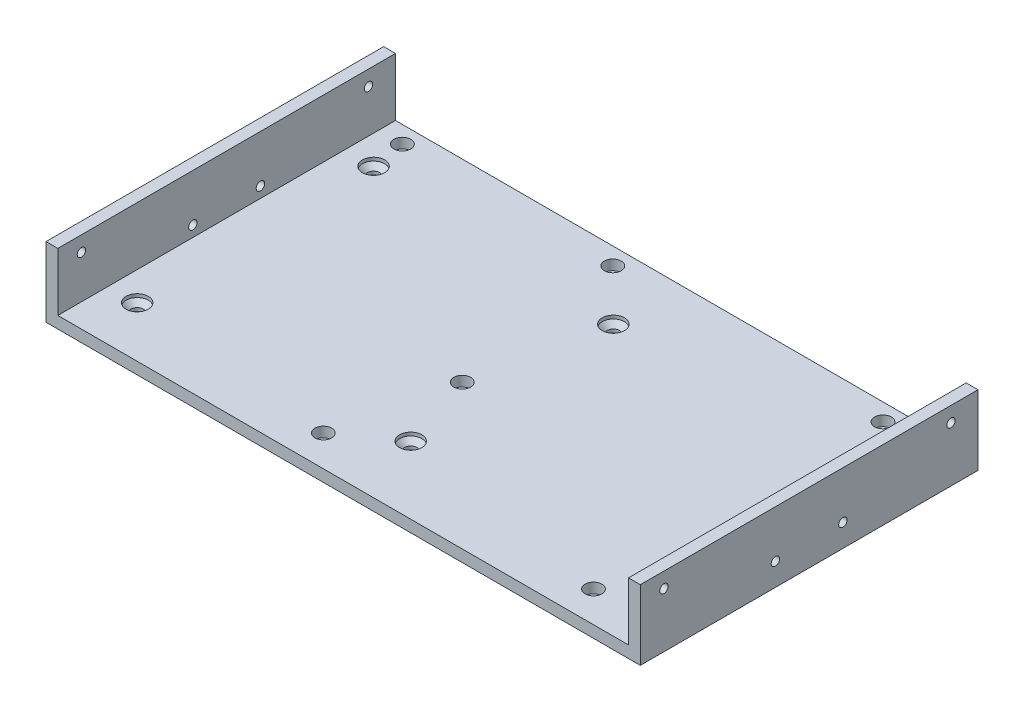
from build123d import *

# Parameters (mm, degrees)
EXTRUDE_1_DEPTH              = 100
HOLE_WIZARD_2_5_2_5_1_D      = 2.5
HOLE_WIZARD_2_5_2_5_1_DEPTH  = 3
HOLE_WIZARD_M2_51_D          = 2.05
HOLE_WIZARD_M2_51_DEPTH      = 3
HOLE_WIZARD_M31_D            = 2.5
HOLE_WIZARD_M31_DEPTH        = 3
HOLE_WIZARD_M41_D            = 3.3
HOLE_WIZARD_M41_DEPTH        = 3
HOLE_WIZARD_M32_D            = 2.5
HOLE_WIZARD_M32_DEPTH        = 3.5
HOLE_WIZARD_M33_D            = 2.5
HOLE_WIZARD_M33_DEPTH        = 5.5
HOLE_WIZARD_M31_2_AT_2_COUNT = 2
HOLE_WIZARD_M31_2_AT_2_PITCH = 76.164296097
HOLE_WIZARD_M31_2_AT_3_COUNT = 2
HOLE_WIZARD_M31_2_AT_3_PITCH = 152
HOLE_WIZARD_M31_2_AT_4_COUNT = 2
HOLE_WIZARD_M31_2_AT_4_PITCH = 70
HOLE_WIZARD_M31_2_AT_5_COUNT = 2
HOLE_WIZARD_M31_2_AT_5_PITCH = 100.004999875
HOLE_WIZARD_M31_2_AT_6_COUNT = 2
HOLE_WIZARD_M31_2_AT_6_PITCH = 167.343957166
HOLE_WIZARD_5_0_5_1_D        = 5
HOLE_WIZARD_5_0_5_1_DEPTH    = 3


with BuildPart() as part:
    # Эскиз1 → Вытянуть-Тонкостенный1 (new body)
    with BuildSketch(Plane.XY):
        Polygon((0, 20.7), (0, 0), (176, 0), (176, 20.7), (172.5, 20.7), (172.5, 3.5), (3.5, 3.5), (3.5, 20.7), align=None)
    extrude(amount=EXTRUDE_1_DEPTH)

    # Диаметр отверстия Ø2.5 (2.5)1
    with Locations(Plane(origin=(0, 0, 0), x_dir=(-1, 0, 0), z_dir=(0, -1, 0))):
        with Locations((-5, -92.5), (-171, -7.5)):
            Hole(HOLE_WIZARD_2_5_2_5_1_D / 2, depth=HOLE_WIZARD_2_5_2_5_1_DEPTH)

    # Отверстие обработанное метчиком M2,51
    with Locations(Plane(origin=(0, 0, 0), x_dir=(-1, 0, 0), z_dir=(0, -1, 0))):
        with Locations((-19.45, -93.75), (-60.45, -93.75), (-136.45, -93.75), (-136.45, -6.75), (-49.25, -6.75), (-19.45, -6.75)):
            Hole(HOLE_WIZARD_M2_51_D / 2, depth=HOLE_WIZARD_M2_51_DEPTH)

    # Hole Wizard M31
    with Locations(Plane(origin=(0, 0, 0), x_dir=(-1, 0, 0), z_dir=(0, -1, 0))):
        with Locations((-28, -87.5), (-88, -87.5), (-148, -87.5), (-148, -12.5), (-88, -12.5), (-28, -12.5)):
            Hole(HOLE_WIZARD_M31_D / 2, depth=HOLE_WIZARD_M31_DEPTH)

    # Отверстие обработанное метчиком M41
    with Locations(Plane(origin=(0, 0, 0), x_dir=(-1, 0, 0), z_dir=(0, -1, 0))):
        with Locations((-50.5, -87.5), (-125.7, -87.5), (-125.7, -12.5), (-50.5, -12.5)):
            Hole(HOLE_WIZARD_M41_D / 2, depth=HOLE_WIZARD_M41_DEPTH)

    # Отверстие обработанное метчиком M32
    with Locations(Plane(origin=(176, 0, 0), x_dir=(0, 0, -1), z_dir=(1, 0, 0))):
        with Locations((-93, 16.2), (-60, 6.7), (-40, 6.7), (-8, 16.2)):
            Hole(HOLE_WIZARD_M32_D / 2, depth=HOLE_WIZARD_M32_DEPTH)

    # Отверстие обработанное метчиком M33
    with Locations(Plane.ZY):
        with Locations((93, 16.2), (60, 6.7), (40, 6.7), (8, 16.2)):
            Hole(HOLE_WIZARD_M33_D / 2, depth=HOLE_WIZARD_M33_DEPTH)

    # Эскиз14 → Hole Wizard M31 2 (revolve, cut)
    with BuildSketch(Plane(origin=(12, 3.5, 15), x_dir=(0, 0, 1), z_dir=(1, 0, 0))):
        Polygon((0, 0), (0, 3.5), (1.8, 3.5), (1.8, 2.5), (3.3, 1), (3.3, 0), align=None)
    hole_wizard_m31_2 = revolve(axis=Axis((12, 9.85, 15), (0, -1, 0)), mode=Mode.SUBTRACT)

    # Hole Wizard M31 2 at 2: Hole Wizard M31 2 ×2
    with Locations(*[Vector(0.9978428725040861, 0, 0.06564755740158466) * (i * HOLE_WIZARD_M31_2_AT_2_PITCH) for i in range(1, HOLE_WIZARD_M31_2_AT_2_COUNT)]):
        add(hole_wizard_m31_2, mode=Mode.SUBTRACT)

    # Hole Wizard M31 2 at 3: Hole Wizard M31 2 ×2
    with Locations(*[(i * HOLE_WIZARD_M31_2_AT_3_PITCH, 0, 0) for i in range(1, HOLE_WIZARD_M31_2_AT_3_COUNT)]):
        add(hole_wizard_m31_2, mode=Mode.SUBTRACT)

    # Hole Wizard M31 2 at 4: Hole Wizard M31 2 ×2
    with Locations(*[(0, 0, i * HOLE_WIZARD_M31_2_AT_4_PITCH) for i in range(1, HOLE_WIZARD_M31_2_AT_4_COUNT)]):
        add(hole_wizard_m31_2, mode=Mode.SUBTRACT)

    # Hole Wizard M31 2 at 5: Hole Wizard M31 2 ×2
    with Locations(*[Vector(0.7599620028497626, 0, 0.649967502437297) * (i * HOLE_WIZARD_M31_2_AT_5_PITCH) for i in range(1, HOLE_WIZARD_M31_2_AT_5_COUNT)]):
        add(hole_wizard_m31_2, mode=Mode.SUBTRACT)

    # Hole Wizard M31 2 at 6: Hole Wizard M31 2 ×2
    with Locations(*[Vector(0.9083088662063591, 0, 0.41830013575292857) * (i * HOLE_WIZARD_M31_2_AT_6_PITCH) for i in range(1, HOLE_WIZARD_M31_2_AT_6_COUNT)]):
        add(hole_wizard_m31_2, mode=Mode.SUBTRACT)

    # Диаметр отверстия Ø5.0 (5)1
    with Locations(Plane(origin=(0, 3.5, 0), x_dir=(1, 0, 0), z_dir=(0, 1, 0))):
        with Locations((165.42, -5.05), (152.97, -5.12), (72.96, -5.12), (10.58, -5.05), (80.5, -57.25), (72.96, -90.84), (152.97, -90.84)):
            Hole(HOLE_WIZARD_5_0_5_1_D / 2, depth=HOLE_WIZARD_5_0_5_1_DEPTH)


solid = part.part
